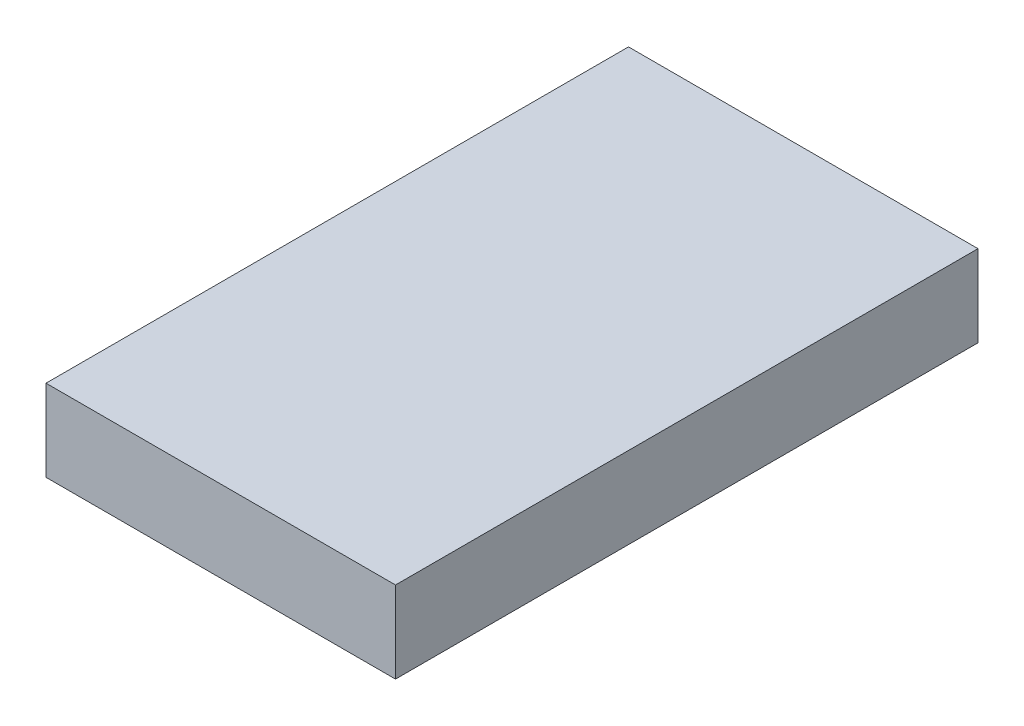
from build123d import *

# Parameters (mm, degrees)
SKETCH1_W           = 15
SKETCH1_H           = 25
BOSS_EXTRUDE1_DEPTH = 1.75


with BuildPart() as part:
    # Sketch1 → Boss-Extrude1 (new, symmetric)
    with BuildSketch(Plane(origin=(0, 0, 0), x_dir=(1, 0, 0), z_dir=(0, 1, 0))):
        Rectangle(SKETCH1_W, SKETCH1_H)
    extrude(amount=BOSS_EXTRUDE1_DEPTH, both=True)


solid = part.part
